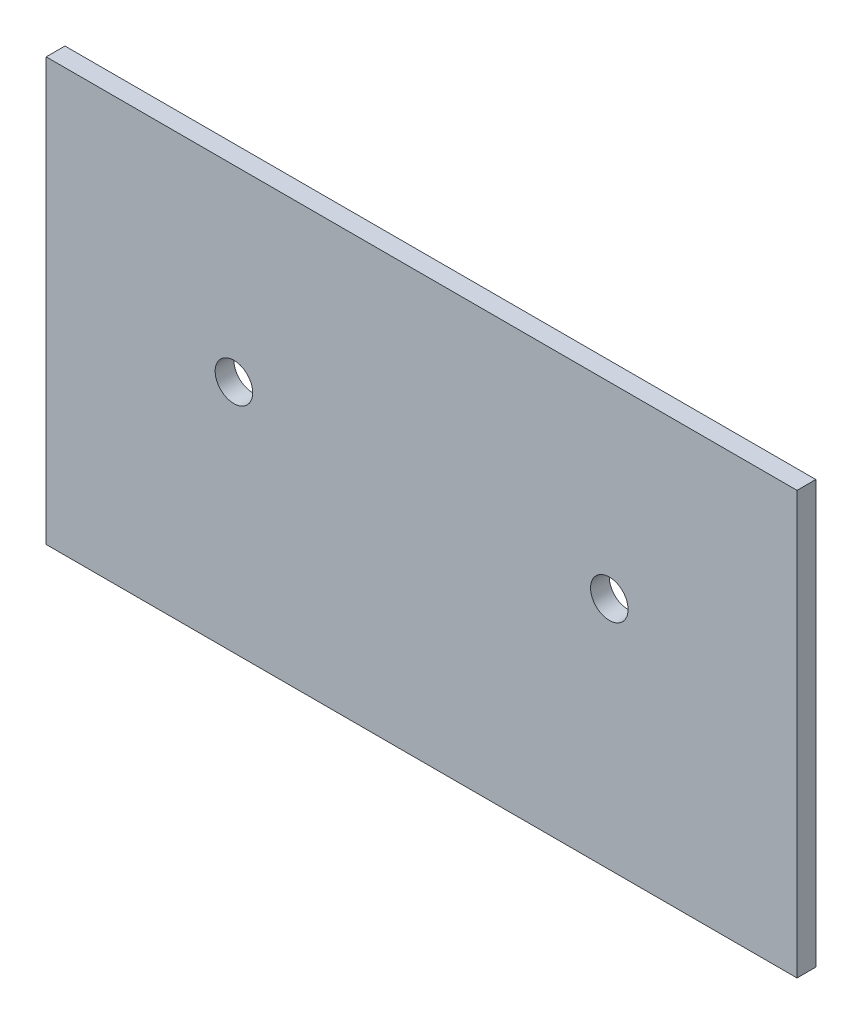
from build123d import *

# Parameters (mm, degrees)
SKETCH1_W           = 80
SKETCH1_H           = 45
BOSS_EXTRUDE1_DEPTH = 2
SKETCH2_R           = 2
CUT_EXTRUDE1_DEPTH  = 2


with BuildPart() as part:
    # Sketch1 → Boss-Extrude1 (new body)
    with BuildSketch(Plane.XY):
        Rectangle(SKETCH1_W, SKETCH1_H)
    extrude(amount=BOSS_EXTRUDE1_DEPTH)

    # Sketch2 → Cut-Extrude1 (cut)
    with BuildSketch(Plane.XY.offset(2)):
        with Locations((-20, 2.5)):
            Circle(SKETCH2_R)
        with Locations((20, 2.5)):
            Circle(SKETCH2_R)
    extrude(amount=-CUT_EXTRUDE1_DEPTH, mode=Mode.SUBTRACT)


solid = part.part
